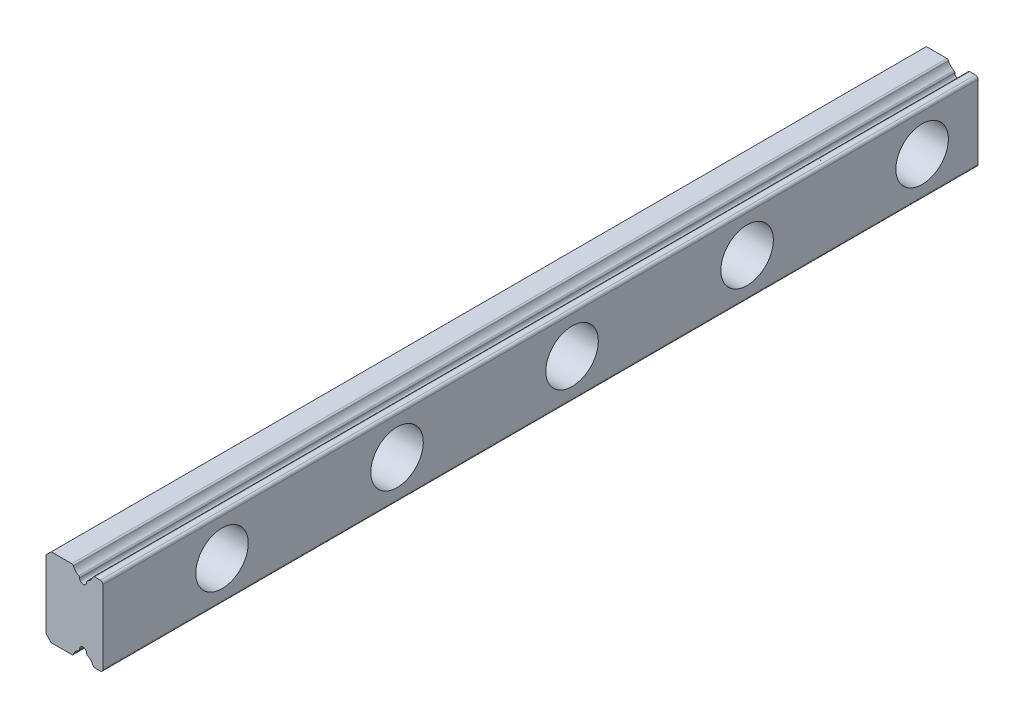
from build123d import *

# Parameters (mm, degrees)
EXTRUDE_1_DEPTH     = 100
SKETCH_2_R          = 1.75
CUT_EXTRUDE_1_DEPTH = 100
SKETCH_3_R          = 3
CUT_EXTRUDE_2_DEPTH = 4.5


with BuildPart() as part:
    # 草图1 → 凸台-拉伸1 (new body)
    with BuildSketch(Plane.XY):
        with BuildLine():
            Line((2.95, 4.5), (2.307669683, 4.5))
            ThreePointArc((2.307669683, 4.5), (2.194280341, 4.464750894), (2.120859728, 4.371428571))
            ThreePointArc((2.120859728, 4.371428571), (1.880846451, 3.985070843), (1.514285714, 3.715790517))
            ThreePointArc((1.514285714, 3.715790517), (1.430969149, 3.641993433), (1.4, 3.535088936))
            Line((1.4, 3.535088936), (1.4, 3.5))
            ThreePointArc((1.4, 3.5), (1, 3.1), (0.6, 3.5))
            Line((0.6, 3.5), (0.6, 3.535088936))
            ThreePointArc((0.6, 3.535088936), (0.569030851, 3.641993433), (0.485714286, 3.715790517))
            ThreePointArc((0.485714286, 3.715790517), (0.119153549, 3.985070843), (-0.120859728, 4.371428571))
            ThreePointArc((-0.120859728, 4.371428571), (-0.194280341, 4.464750894), (-0.307669683, 4.5))
            Line((-0.307669683, 4.5), (-2.65, 4.5))
            Line((-2.65, 4.5), (-3.25, 3.9))
            Line((-3.25, 3.9), (-3.25, -3.9))
            Line((-3.25, -3.9), (-2.65, -4.5))
            Line((-2.65, -4.5), (-0.307669683, -4.5))
            ThreePointArc((-0.307669683, -4.5), (-0.194280341, -4.464750894), (-0.120859728, -4.371428571))
            ThreePointArc((-0.120859728, -4.371428571), (0.119153549, -3.985070843), (0.485714286, -3.715790517))
            ThreePointArc((0.485714286, -3.715790517), (0.569030851, -3.641993433), (0.6, -3.535088936))
            Line((0.6, -3.535088936), (0.6, -3.5))
            ThreePointArc((0.6, -3.5), (1, -3.1), (1.4, -3.5))
            Line((1.4, -3.5), (1.4, -3.535088936))
            ThreePointArc((1.4, -3.535088936), (1.430969149, -3.641993433), (1.514285714, -3.715790517))
            ThreePointArc((1.514285714, -3.715790517), (1.880846451, -3.985070843), (2.120859728, -4.371428571))
            ThreePointArc((2.120859728, -4.371428571), (2.194280341, -4.464750894), (2.307669683, -4.5))
            Line((2.307669683, -4.5), (2.95, -4.5))
            ThreePointArc((2.95, -4.5), (3.162132034, -4.412132034), (3.25, -4.2))
            Line((3.25, -4.2), (3.25, 4.2))
            ThreePointArc((3.25, 4.2), (3.162132034, 4.412132034), (2.95, 4.5))
        make_face()
    extrude(amount=EXTRUDE_1_DEPTH)

    # 草图2 → 切除-拉伸1 (cut)
    with BuildSketch(Plane(origin=(3.25, 0, 0), x_dir=(0, 0, -1), z_dir=(1, 0, 0))):
        with Locations(Location((-6.386586206, 0, 0), (0, 0, 90))):
            Circle(SKETCH_2_R)
        with Locations(Location((-26.386586206, 0, 0), (0, 0, 90))):
            Circle(SKETCH_2_R)
        with Locations(Location((-46.386586206, 0, 0), (0, 0, 90))):
            Circle(SKETCH_2_R)
        with Locations(Location((-66.386586206, 0, 0), (0, 0, 90))):
            Circle(SKETCH_2_R)
        with Locations(Location((-86.386586206, 0, 0), (0, 0, 90))):
            Circle(SKETCH_2_R)
    extrude(amount=-CUT_EXTRUDE_1_DEPTH, mode=Mode.SUBTRACT)

    # 草图3 → 切除-拉伸2 (cut)
    with BuildSketch(Plane(origin=(3.25, 0, 0), x_dir=(0, 0, -1), z_dir=(1, 0, 0))):
        with Locations(Location((-6.386586206, 0, 0), (0, 0, 90))):
            Circle(SKETCH_3_R)
        with Locations(Location((-26.386586206, 0, 0), (0, 0, 90))):
            Circle(SKETCH_3_R)
        with Locations(Location((-46.386586206, 0, 0), (0, 0, 90))):
            Circle(SKETCH_3_R)
        with Locations(Location((-66.386586206, 0, 0), (0, 0, 90))):
            Circle(SKETCH_3_R)
        with Locations(Location((-86.386586206, 0, 0), (0, 0, 90))):
            Circle(SKETCH_3_R)
    extrude(amount=-CUT_EXTRUDE_2_DEPTH, mode=Mode.SUBTRACT)


solid = part.part
